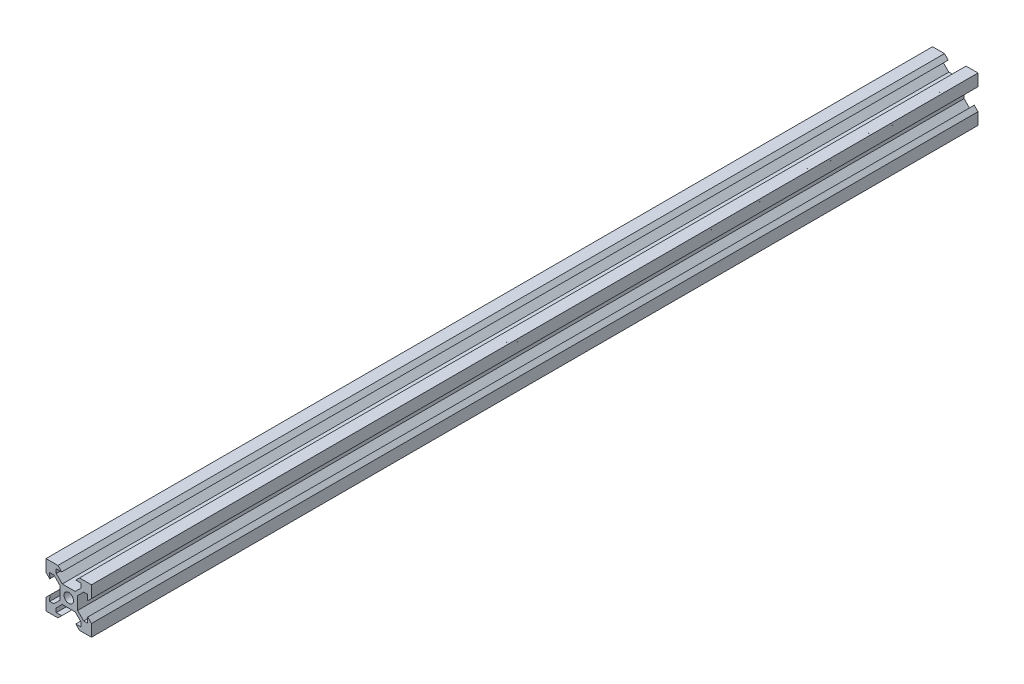
from build123d import *

# Parameters (mm, degrees)
SKETCH1_R           = 2.1
BOSS_EXTRUDE1_DEPTH = 195


with BuildPart() as part:
    # Sketch1 → Boss-Extrude1 (new, symmetric)
    with BuildSketch(Plane.XY):
        Polygon((2.834320347, 3.893970342), (5.5, 6.558849663), (5.5, 8.349069506), (3.1, 8.349069506), (4.75, 9.998574117), (10, 9.998574117), (10, 4.746997406), (8.35, 3.097492795), (8.350720674, 5.497492687), (6.560500912, 5.498030255), (3.894821259, 2.833150935), (3.894821259, -2.833150935), (6.560500912, -5.498030255), (8.350720674, -5.497492687), (8.35, -3.097492795), (10, -4.746997406), (10, -9.998574117), (4.75, -9.998574117), (3.1, -8.349069506), (5.5, -8.349069506), (5.5, -6.558849663), (2.834320347, -3.893970342), (-2.834320347, -3.893970342), (-5.5, -6.558849663), (-5.5, -8.349069506), (-3.1, -8.349069506), (-4.75, -9.998574117), (-10, -9.998574117), (-10, -4.746997406), (-8.35, -3.097492795), (-8.350720674, -5.497492687), (-6.560500912, -5.498030255), (-3.894821259, -2.833150935), (-3.894821259, 2.833150935), (-6.560500912, 5.498030255), (-8.350720674, 5.497492687), (-8.35, 3.097492795), (-10, 4.746997406), (-10, 9.998574117), (-4.75, 9.998574117), (-3.1, 8.349069506), (-5.5, 8.349069506), (-5.5, 6.558849663), (-2.834320347, 3.893970342), align=None)
        Circle(SKETCH1_R, mode=Mode.SUBTRACT)
    extrude(amount=BOSS_EXTRUDE1_DEPTH, both=True)


solid = part.part
